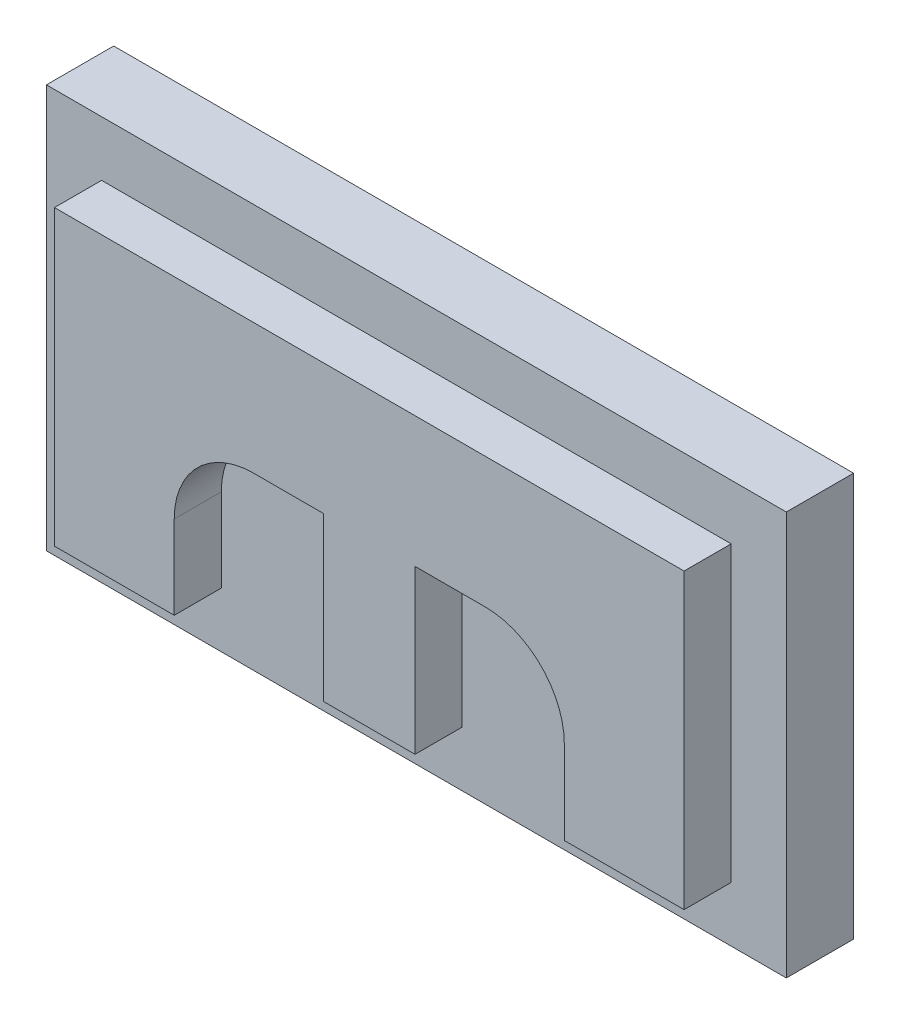
from build123d import *

# Parameters (mm, degrees)
SKETCH1_W            = 110
SKETCH1_H            = 60
BOSS_EXTRUDE1_DEPTH  = 10
SKETCH3_W            = 93.6
SKETCH3_H            = 43.6
BOSS_EXTRUDE2_DEPTH  = 7
SKETCH4_W            = 22.2
SKETCH4_H            = 24.2
CUT_EXTRUDE1_DEPTH   = 7
FILLET1_R            = 11.8
FILLET1_OF_MIRROR1_R = 11.8


with BuildPart() as part:
    # Sketch1 → Boss-Extrude1 (new body)
    with BuildSketch(Plane.XY):
        with Locations((55, 30)):
            Rectangle(SKETCH1_W, SKETCH1_H)
    extrude(amount=BOSS_EXTRUDE1_DEPTH)

    # Sketch3 → Boss-Extrude2 (add)
    with BuildSketch(Plane.XY.offset(10)):
        with Locations((55, 30)):
            Rectangle(SKETCH3_W, SKETCH3_H)
    extrude(amount=BOSS_EXTRUDE2_DEPTH)

    # Sketch4 → Cut-Extrude1 (cut)
    with BuildSketch(Plane.XY.offset(17)):
        with Locations((37.1, 20.3)):
            Rectangle(SKETCH4_W, SKETCH4_H)
    cut_extrude1 = extrude(amount=-CUT_EXTRUDE1_DEPTH, mode=Mode.SUBTRACT)

    # Fillet1
    fillet1_edges = [part.edges().sort_by_distance(p)[0] for p in [
        (26, 32.4, 13.5),
    ]]
    fillet(fillet1_edges, radius=FILLET1_R)

    # Mirror1: Cut-Extrude1 across plane
    add(cut_extrude1.mirror(Plane.ZY.offset(-55)), mode=Mode.SUBTRACT)

    # Fillet1 of Mirror1
    fillet1_of_mirror1_edges = [part.edges().sort_by_distance(p)[0] for p in [
        (84, 32.4, 13.5),
    ]]
    fillet(fillet1_of_mirror1_edges, radius=FILLET1_OF_MIRROR1_R)


solid = part.part
